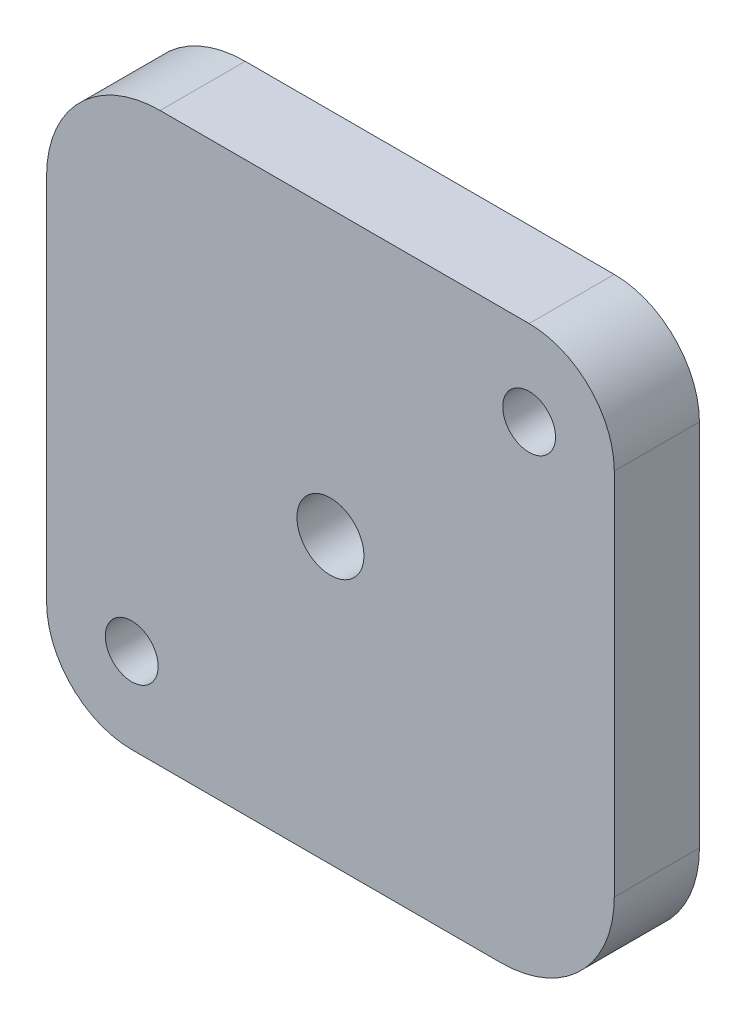
from build123d import *

# Parameters (mm, degrees)
SKETCH1_W           = 100
SKETCH1_H           = 100
BOSS_EXTRUDE1_DEPTH = 15
SKETCH2_R           = 4.65
CUT_EXTRUDE1_DEPTH  = 73.284161474
SKETCH10_R          = 5.9
CUT_EXTRUDE5_DEPTH  = 73.284161474
FILLET1_R           = 20
FILLET2_R           = 15


with BuildPart() as part:
    # Sketch1 → Boss-Extrude1 (new body)
    with BuildSketch(Plane.XY):
        Rectangle(SKETCH1_W, SKETCH1_H)
    extrude(amount=BOSS_EXTRUDE1_DEPTH)

    # Sketch2 → Cut-Extrude1 (cut, through all)
    with BuildSketch(Plane.XY.offset(15)):
        with Locations((35, 35)):
            Circle(SKETCH2_R)
        with Locations(Location((-35, -35, 0), (0, 0, 180))):
            Circle(SKETCH2_R)
    extrude(amount=-CUT_EXTRUDE1_DEPTH, mode=Mode.SUBTRACT)

    # Sketch10 → Cut-Extrude5 (cut, through all)
    with BuildSketch(Plane.XY.offset(15)):
        Circle(SKETCH10_R)
    extrude(amount=-CUT_EXTRUDE5_DEPTH, mode=Mode.SUBTRACT)

    # Fillet1
    fillet1_edges = [part.edges().sort_by_distance(p)[0] for p in [
        (-50, 50, 7.5),
        (50, -50, 7.5),
    ]]
    fillet(fillet1_edges, radius=FILLET1_R)

    # Fillet2
    fillet2_edges = [part.edges().sort_by_distance(p)[0] for p in [
        (50, 50, 7.5),
        (-50, -50, 7.5),
    ]]
    fillet(fillet2_edges, radius=FILLET2_R)


solid = part.part
